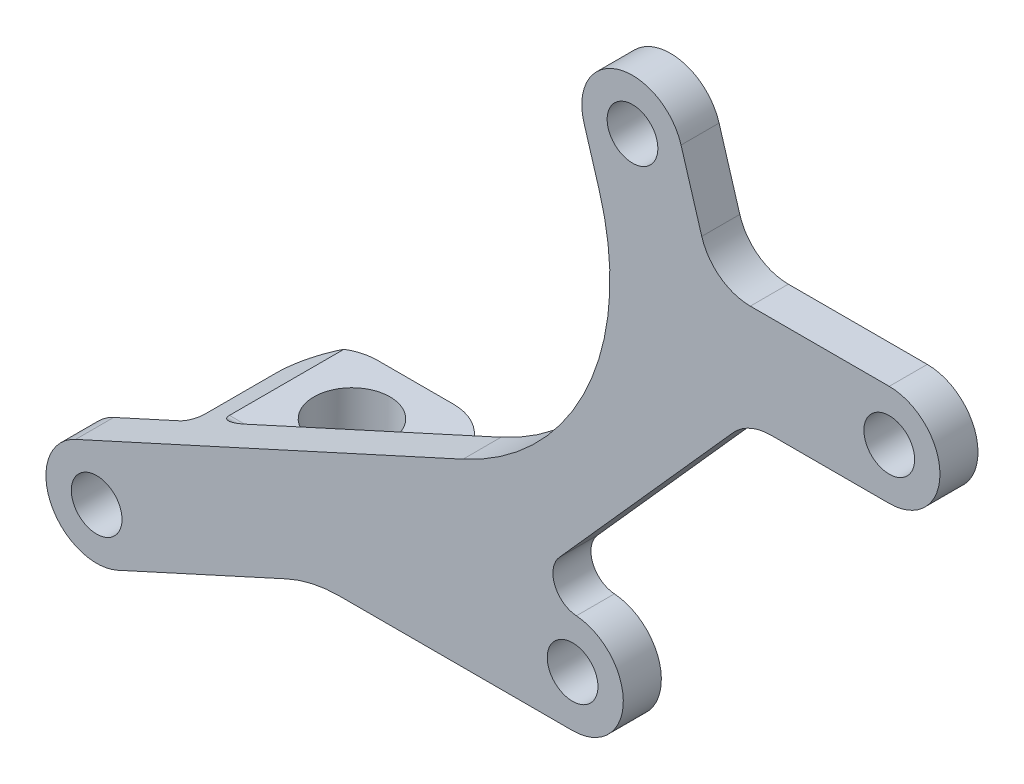
from build123d import *

# Parameters (mm, degrees)
ESQUISSE1_R             = 1
BOSS_EXTRU_1_DEPTH      = 1.5
CONG_1_R                = 2
CONG_2_R                = 1
ESQUISSE2_W             = 7
ESQUISSE2_H             = 2
BOSS_EXTRU_2_DEPTH      = 5.3
CONG_3_R                = 0.5
CONG_4_R                = 0.5
CONG_5_R                = 2
CONG_6_R                = 2
ESQUISSE3_R             = 1.5
ENL_V_MAT_EXTRU_1_DEPTH = 5
CONG_7_R                = 5
ENL_V_MAT_EXTRU_2_DEPTH = 6


with BuildPart() as part:
    # Esquisse1 → Boss.-Extru.1 (new body)
    with BuildSketch(Plane.XY):
        with BuildLine():
            Line((5.725874922, 0), (15.999999988, 0))
            ThreePointArc((15.999999988, 0), (18.000588979, 2.000588991), (15.999999988, 4.001177983))
            Line((15.999999988, 4.001177983), (13.999999884, 4.001177983))
            Line((13.999999884, 4.001177983), (22.919071704, 14.001177983))
            Line((22.919071704, 14.001177983), (28.487225861, 14.001177983))
            ThreePointArc((28.487225861, 14.001177983), (30.487225861, 16.001177983), (28.487225861, 18.001177983))
            Line((28.487225861, 18.001177983), (21.522063421, 18.001177983))
            Line((21.522063421, 18.001177983), (20.277949706, 22.137339224))
            ThreePointArc((20.277949706, 22.137339224), (17.786631004, 23.476492361), (16.447477867, 20.98517366))
            Line((16.447477867, 20.98517366), (17.053942849, 18.968929547))
            ThreePointArc((17.053942849, 18.968929547), (16.590729073, 12.03075257), (11.678911432, 7.108668233))
            Line((11.678911432, 7.108668233), (-3.597341835, 0.147035641))
            ThreePointArc((-3.597341835, 0.147035641), (-4.587900453, -2.502264951), (-1.938599861, -3.492823569))
            Line((-1.938599861, -3.492823569), (5.725874922, 0))
        make_face()
        with Locations((28.487225861, 16.001177983)):
            Circle(ESQUISSE1_R, mode=Mode.SUBTRACT)
        with Locations((15.999999988, 2.000588991)):
            Circle(ESQUISSE1_R, mode=Mode.SUBTRACT)
        with Locations((18.362713786, 21.561256442)):
            Circle(ESQUISSE1_R, mode=Mode.SUBTRACT)
        with Locations((-2.767970848, -1.672893964)):
            Circle(ESQUISSE1_R, mode=Mode.SUBTRACT)
    extrude(amount=BOSS_EXTRU_1_DEPTH)

    # Congé1
    cong_1_edges = [part.edges().sort_by_distance(p)[0] for p in [
        (21.522063421, 18.001177983, 0.75),
        (22.919071704, 14.001177983, 0.75),
    ]]
    fillet(cong_1_edges, radius=CONG_1_R)

    # Congé2
    cong_2_edges = [part.edges().sort_by_distance(p)[0] for p in [
        (13.999999884, 4.001177983, 0.75),
    ]]
    fillet(cong_2_edges, radius=CONG_2_R)

    # Esquisse2 → Boss.-Extru.2 (add)
    with BuildSketch(Plane(origin=(0, 0, 0), x_dir=(-1, 0, 0), z_dir=(0, 0, -1))):
        with Locations((-2.999999988, 1)):
            Rectangle(ESQUISSE2_W, ESQUISSE2_H)
    extrude(amount=BOSS_EXTRU_2_DEPTH)

    # Congé3
    cong_3_edges = [part.edges().sort_by_distance(p)[0] for p in [
        (3.484354553, 2, 0),
    ]]
    fillet(cong_3_edges, radius=CONG_3_R)

    # Congé4
    cong_4_edges = [part.edges().sort_by_distance(p)[0] for p in [
        (-0.500000012, 0.779271889, 0),
    ]]
    fillet(cong_4_edges, radius=CONG_4_R)

    # Congé5
    cong_5_edges = [part.edges().sort_by_distance(p)[0] for p in [
        (6.499999988, 1.25, 0),
    ]]
    fillet(cong_5_edges, radius=CONG_5_R)

    # Congé6
    cong_6_edges = [part.edges().sort_by_distance(p)[0] for p in [
        (6.499999988, 1, -5.3),
        (-0.500000012, 1, -5.3),
    ]]
    fillet(cong_6_edges, radius=CONG_6_R)

    # Esquisse3 → Enlèv. mat.-Extru.1 (cut)
    with BuildSketch(Plane(origin=(0, 2, 0), x_dir=(1, 0, 0), z_dir=(0, 1, 0))):
        with Locations(Location((2.999999988, 2.8, 0), (0, 0, 270))):
            Circle(ESQUISSE3_R)
    extrude(amount=-ENL_V_MAT_EXTRU_1_DEPTH, mode=Mode.SUBTRACT)

    # Congé7
    cong_7_edges = [part.edges().sort_by_distance(p)[0] for p in [
        (5.725874922, 0, 0.75),
    ]]
    fillet(cong_7_edges, radius=CONG_7_R)

    # Esquisse4 → Enlèv. mat.-Extru.2 (cut)
    with BuildSketch(Plane.XY):
        Polygon((-0.500000012, 1.558543777), (0.468709119, 2), (-0.500000012, 2), align=None)
    extrude(amount=-ENL_V_MAT_EXTRU_2_DEPTH, mode=Mode.SUBTRACT)


solid = part.part
